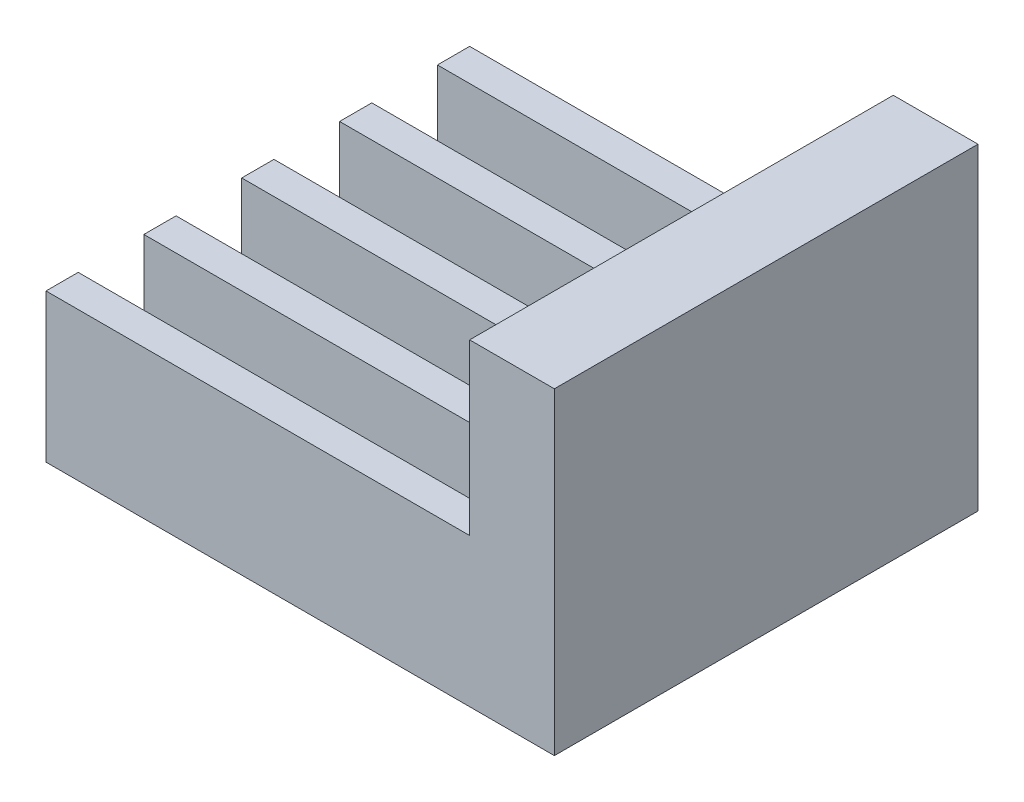
from build123d import *

# Parameters (mm, degrees)
SKETCH1_W           = 120
SKETCH1_H           = 100
BOSS_EXTRUDE1_DEPTH = 75
SKETCH2_W           = 100
SKETCH2_H           = 100
CUT_EXTRUDE1_DEPTH  = 40
SKETCH6_W           = 15.5
SKETCH6_H           = 15.5
CUT_EXTRUDE4_DEPTH  = 100
SKETCH8_W           = 19.1
SKETCH8_H           = 10
CUT_EXTRUDE5_DEPTH  = 100
SKETCH6_3_R         = 5.95
CUT_EXTRUDE6_DEPTH  = 111


with BuildPart() as part:
    # Sketch1 → Boss-Extrude1 (new body)
    with BuildSketch(Plane(origin=(0, 0, 0), x_dir=(1, 0, 0), z_dir=(0, 1, 0))):
        with Locations((-3.53539823, -7.581858407)):
            Rectangle(SKETCH1_W, SKETCH1_H)
    extrude(amount=BOSS_EXTRUDE1_DEPTH)

    # Sketch2 → Cut-Extrude1 (cut)
    with BuildSketch(Plane(origin=(0, 75, 0), x_dir=(1, 0, 0), z_dir=(0, 1, 0))):
        with Locations((-13.53539823, -7.581858407)):
            Rectangle(SKETCH2_W, SKETCH2_H)
    extrude(amount=-CUT_EXTRUDE1_DEPTH, mode=Mode.SUBTRACT)

    # Sketch6 → Cut-Extrude4 (cut)
    with BuildSketch(Plane.ZY.offset(63.53539823)):
        with Locations((-27.068141593, 27.25)):
            Rectangle(SKETCH6_W, SKETCH6_H)
        with Locations((-3.968141593, 27.25)):
            Rectangle(SKETCH6_W, SKETCH6_H)
        with Locations((19.131858407, 27.25)):
            Rectangle(SKETCH6_W, SKETCH6_H)
        with Locations((42.231858407, 27.25)):
            Rectangle(SKETCH6_W, SKETCH6_H)
    extrude(amount=-CUT_EXTRUDE4_DEPTH, mode=Mode.SUBTRACT)

    # Sketch8 → Cut-Extrude5 (cut)
    with BuildSketch(Plane.ZY.offset(63.53539823)):
        with Locations((-27.068141593, 14.5)):
            Rectangle(SKETCH8_W, SKETCH8_H)
        with Locations((-3.968141593, 14.5)):
            Rectangle(SKETCH8_W, SKETCH8_H)
        with Locations((42.231858407, 14.5)):
            Rectangle(SKETCH8_W, SKETCH8_H)
        with Locations((19.131858407, 14.5)):
            Rectangle(SKETCH8_W, SKETCH8_H)
    extrude(amount=-CUT_EXTRUDE5_DEPTH, mode=Mode.SUBTRACT)

    # Sketch6<3> → Cut-Extrude6 (cut)
    with BuildSketch(Plane.ZY.offset(63.53539823)):
        with Locations((-27.068141593, 27.25)):
            Circle(SKETCH6_3_R)
        with Locations((-3.968141593, 27.25)):
            Circle(SKETCH6_3_R)
        with Locations((42.231858407, 27.25)):
            Circle(SKETCH6_3_R)
        with Locations((19.131858407, 27.25)):
            Circle(SKETCH6_3_R)
    extrude(amount=-CUT_EXTRUDE6_DEPTH, mode=Mode.SUBTRACT)


solid = part.part
